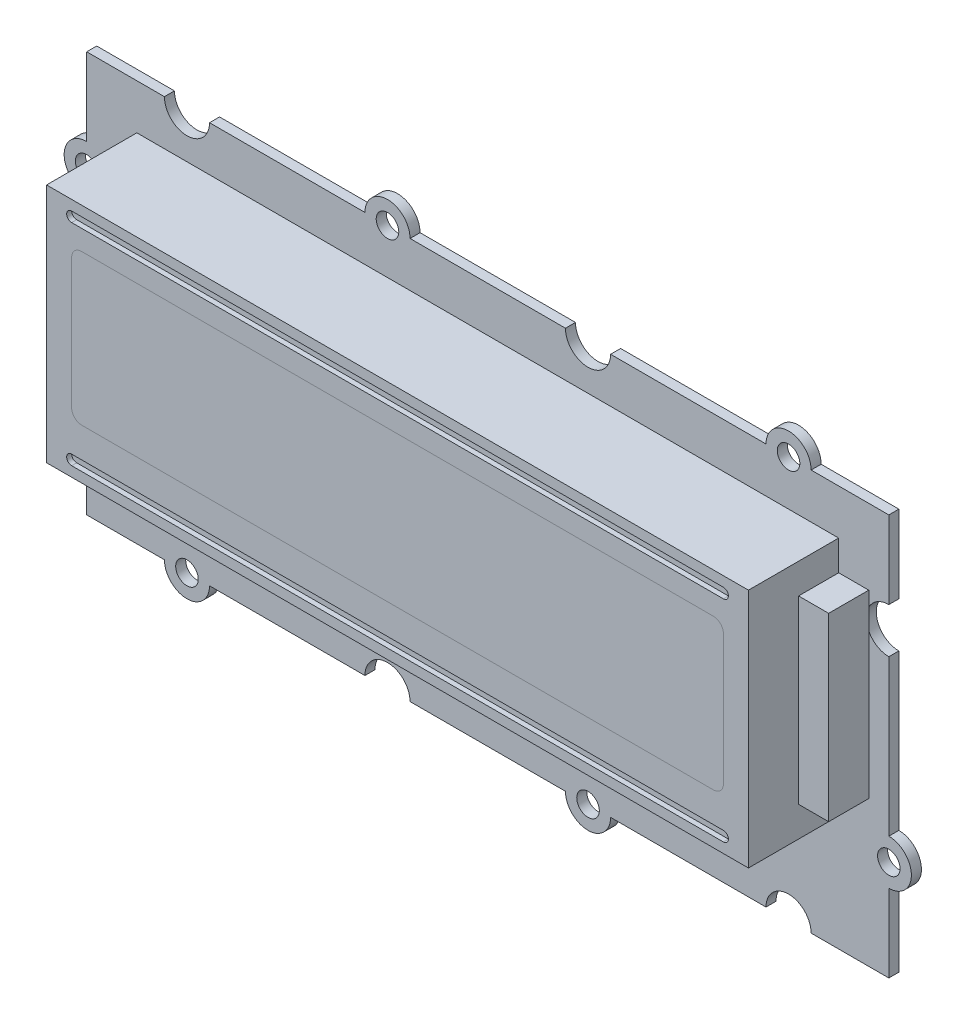
from build123d import *

# Parameters (mm, degrees)
ESQUISSE1_R             = 1.125
BOSS_EXTRU_1_DEPTH      = 1
ESQUISSE2_W             = 70
ESQUISSE2_H             = 24
BOSS_EXTRU_2_DEPTH      = 9
ENL_V_MAT_EXTRU_1_DEPTH = 0.5
BOSS_EXTRU_4_DEPTH      = 1
ESQUISSE5_W             = 4
ESQUISSE5_H             = 18
BOSS_EXTRU_5_DEPTH      = 3


with BuildPart() as part:
    # Esquisse1 → Boss.-Extru.1 (new body)
    with BuildSketch(Plane.XY):
        with BuildLine():
            Line((-40, 20), (-32.25, 20))
            ThreePointArc((-32.25, 20), (-30, 17.75), (-27.75, 20))
            Line((-27.75, 20), (-12.25, 20))
            ThreePointArc((-12.25, 20), (-10, 22.25), (-7.75, 20))
            Line((-7.75, 20), (7.75, 20))
            ThreePointArc((7.75, 20), (10, 17.75), (12.25, 20))
            Line((12.25, 20), (27.75, 20))
            ThreePointArc((27.75, 20), (30, 22.25), (32.25, 20))
            Line((32.25, 20), (40, 20))
            Line((40, 20), (40, 12.25))
            ThreePointArc((40, 12.25), (37.75, 10), (40, 7.75))
            Line((40, 7.75), (40, -7.75))
            ThreePointArc((40, -7.75), (42.25, -10), (40, -12.25))
            Line((40, -12.25), (40, -20))
            Line((40, -20), (32.25, -20))
            ThreePointArc((32.25, -20), (30, -17.75), (27.75, -20))
            Line((27.75, -20), (12.25, -20))
            ThreePointArc((12.25, -20), (10, -22.25), (7.75, -20))
            Line((7.75, -20), (-7.75, -20))
            ThreePointArc((-7.75, -20), (-10, -17.75), (-12.25, -20))
            Line((-12.25, -20), (-27.75, -20))
            ThreePointArc((-27.75, -20), (-30, -22.25), (-32.25, -20))
            Line((-32.25, -20), (-40, -20))
            Line((-40, -20), (-40, -12.25))
            ThreePointArc((-40, -12.25), (-37.75, -10), (-40, -7.75))
            Line((-40, -7.75), (-40, 7.75))
            ThreePointArc((-40, 7.75), (-42.25, 10), (-40, 12.25))
            Line((-40, 12.25), (-40, 20))
        make_face()
        with Locations((-10, 20)):
            Circle(ESQUISSE1_R, mode=Mode.SUBTRACT)
        with Locations((30, 20)):
            Circle(ESQUISSE1_R, mode=Mode.SUBTRACT)
        with Locations((-40, 10)):
            Circle(ESQUISSE1_R, mode=Mode.SUBTRACT)
        with Locations(Location((40, -10, 0), (0, 0, 180))):
            Circle(ESQUISSE1_R, mode=Mode.SUBTRACT)
        with Locations(Location((10, -20, 0), (0, 0, 180))):
            Circle(ESQUISSE1_R, mode=Mode.SUBTRACT)
        with Locations(Location((-30, -20, 0), (0, 0, 180))):
            Circle(ESQUISSE1_R, mode=Mode.SUBTRACT)
    extrude(amount=BOSS_EXTRU_1_DEPTH)

    # Esquisse2 → Boss.-Extru.2 (add)
    with BuildSketch(Plane.XY.offset(1)):
        with Locations((0, 3.5)):
            Rectangle(ESQUISSE2_W, ESQUISSE2_H)
        with BuildLine():
            Line((-31.5, 11.5), (31.5, 11.5))
            ThreePointArc((31.5, 11.5), (32.207106781, 11.207106781), (32.5, 10.5))
            Line((32.5, 10.5), (32.5, -2.5))
            ThreePointArc((32.5, -2.5), (32.207106781, -3.207106781), (31.5, -3.5))
            Line((31.5, -3.5), (-31.5, -3.5))
            ThreePointArc((-31.5, -3.5), (-32.207106781, -3.207106781), (-32.5, -2.5))
            Line((-32.5, -2.5), (-32.5, 10.5))
            ThreePointArc((-32.5, 10.5), (-32.207106781, 11.207106781), (-31.5, 11.5))
        make_face(mode=Mode.SUBTRACT)
    extrude(amount=BOSS_EXTRU_2_DEPTH)

    # Esquisse3 → Enlèv. mat.-Extru.1 (cut)
    with BuildSketch(Plane.XY.offset(10)):
        with BuildLine():
            Line((-32.5, 14.5), (32.5, 14.5))
            ThreePointArc((32.5, 14.5), (33, 14), (32.5, 13.5))
            Line((32.5, 13.5), (-32.5, 13.5))
            ThreePointArc((-32.5, 13.5), (-33, 14), (-32.5, 14.5))
        make_face()
        with BuildLine():
            Line((-32.5, -6.5), (32.5, -6.5))
            ThreePointArc((32.5, -6.5), (33, -7), (32.5, -7.5))
            Line((32.5, -7.5), (-32.5, -7.5))
            ThreePointArc((-32.5, -7.5), (-33, -7), (-32.5, -6.5))
        make_face()
    extrude(amount=-ENL_V_MAT_EXTRU_1_DEPTH, mode=Mode.SUBTRACT)

    # Esquisse5 → Boss.-Extru.5 (add)
    with BuildSketch(Plane(origin=(35, 0, 0), x_dir=(0, 0, -1), z_dir=(1, 0, 0))):
        with Locations((-3, 3.5)):
            Rectangle(ESQUISSE5_W, ESQUISSE5_H)
    extrude(amount=BOSS_EXTRU_5_DEPTH)


with BuildPart() as body_2:
    # Esquisse4 → Boss.-Extru.4 (new body)
    with BuildSketch(Plane.XY.offset(10)):
        with BuildLine():
            Line((32.5, -2.5), (32.5, 10.5))
            ThreePointArc((32.5, 10.5), (32.207106781, 11.207106781), (31.5, 11.5))
            Line((31.5, 11.5), (-31.5, 11.5))
            ThreePointArc((-31.5, 11.5), (-32.207106781, 11.207106781), (-32.5, 10.5))
            Line((-32.5, 10.5), (-32.5, -2.5))
            ThreePointArc((-32.5, -2.5), (-32.207106781, -3.207106781), (-31.5, -3.5))
            Line((-31.5, -3.5), (31.5, -3.5))
            ThreePointArc((31.5, -3.5), (32.207106781, -3.207106781), (32.5, -2.5))
        make_face()
    extrude(amount=-BOSS_EXTRU_4_DEPTH)


solid = Compound([part.part, body_2.part])
